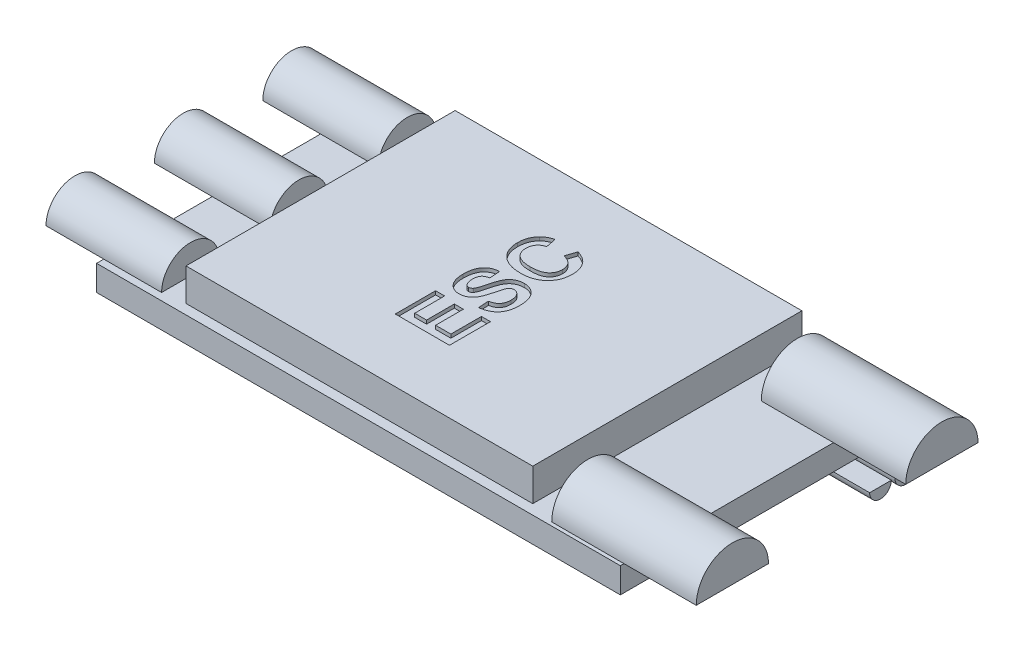
from build123d import *

# Parameters (mm, degrees)
SKETCH1_W           = 29
SKETCH1_H           = 16
BOSS_EXTRUDE1_DEPTH = 0.7
SKETCH2_W           = 19.2
SKETCH2_H           = 14.9
BOSS_EXTRUDE2_DEPTH = 1.8
SKETCH3_W           = 4
SKETCH3_H           = 2
REVOLVE1_ANGLE      = 180
SKETCH4_W           = 3.2
SKETCH4_H           = 1.6
REVOLVE2_ANGLE      = 180
SKETCH5_W           = 3.2
SKETCH5_H           = 1.6
REVOLVE3_ANGLE      = 180
SKETCH6_W           = 2
SKETCH6_H           = 0.6
REVOLVE4_ANGLE      = 180
LPATTERN1_COUNT     = 3
LPATTERN1_PITCH     = 1.4
CUT_EXTRUDE1_DEPTH  = 0.2


with BuildPart() as part:
    # Sketch1 → Boss-Extrude1 (new, symmetric)
    with BuildSketch(Plane(origin=(0, 0, 0), x_dir=(1, 0, 0), z_dir=(0, 1, 0))):
        Rectangle(SKETCH1_W, SKETCH1_H)
    extrude(amount=BOSS_EXTRUDE1_DEPTH, both=True)

    # Sketch2 → Boss-Extrude2 (add)
    with BuildSketch(Plane(origin=(0, 0.7, 0), x_dir=(1, 0, 0), z_dir=(0, 1, 0))):
        with Locations((-0.5, 0)):
            Rectangle(SKETCH2_W, SKETCH2_H)
    extrude(amount=BOSS_EXTRUDE2_DEPTH)

    # Sketch3 → Revolve1 (revolve)
    with BuildSketch(Plane(origin=(0, 0.7, 0), x_dir=(1, 0, 0), z_dir=(0, 1, 0))):
        with Locations((12.5, -4.8)):
            Rectangle(SKETCH3_W, SKETCH3_H)
        with Locations((16.5, -4.8)):
            Rectangle(SKETCH3_W, SKETCH3_H)
    revolve1 = revolve(axis=Axis((10.5, 0.7, 5.8), (1, 0, 0)), revolution_arc=REVOLVE1_ANGLE)

    # Sketch4 → Revolve2 (revolve)
    with BuildSketch(Plane(origin=(0, 0.7, 0), x_dir=(1, 0, 0), z_dir=(0, 1, 0))):
        with Locations((-16.1, 0.8)):
            Rectangle(SKETCH4_W, SKETCH4_H)
        with Locations((-12.9, 0.8)):
            Rectangle(SKETCH4_W, SKETCH4_H)
    revolve(axis=Axis((-17.7, 0.7, 0), (1, 0, 0)), revolution_arc=REVOLVE2_ANGLE)

    # Sketch5 → Revolve3 (revolve)
    with BuildSketch(Plane(origin=(0, 0.7, 0), x_dir=(1, 0, 0), z_dir=(0, 1, 0))):
        with Locations((-16.1, -5.2)):
            Rectangle(SKETCH5_W, SKETCH5_H)
        with Locations((-12.9, -5.2)):
            Rectangle(SKETCH5_W, SKETCH5_H)
    revolve3 = revolve(axis=Axis((-17.7, 0.7, 6), (1, 0, 0)), revolution_arc=REVOLVE3_ANGLE)

    # Mirror1: Revolve1, Revolve3 across plane
    add(revolve1.mirror(Plane.XY))
    add(revolve3.mirror(Plane.XY))

    # Sketch6 → Revolve4 (revolve)
    with BuildSketch(Plane.XZ.offset(0.7)):
        with Locations((13.5, -6.9)):
            Rectangle(SKETCH6_W, SKETCH6_H)
        with Locations((15.5, -6.9)):
            Rectangle(SKETCH6_W, SKETCH6_H)
    revolve4 = revolve(axis=Axis((12.5, -0.7, -7.2), (1, 0, 0)), revolution_arc=REVOLVE4_ANGLE)

    # LPattern1: Revolve4 ×3
    with Locations(*[(0, 0, i * LPATTERN1_PITCH) for i in range(1, LPATTERN1_COUNT)]):
        add(revolve4)

    # Sketch7 → Cut-Extrude1 (cut)
    with BuildSketch(Plane(origin=(0, 2.5, 0), x_dir=(1, 0, 0), z_dir=(0, 1, 0))):
        with BuildLine():
            Line((-0.115384615, 3.5), (0.076923077, 4.076923077))
            add(Edge.make_bspline(
                [(0.076923077, 4.076923077), (0.114750402, 4.065198159), (0.188828203, 4.042237081), (0.295000431, 4.000077848), (0.393390754, 3.951865071), (0.485170733, 3.899351596), (0.567898901, 3.839203039), (0.644462557, 3.775117808), (0.712460788, 3.70423645), (0.773496322, 3.628274922), (0.827172253, 3.546761084), (0.873588033, 3.459843465), (0.912631427, 3.367671275), (0.94447772, 3.270116415), (0.969914847, 3.167544261), (0.986732585, 3.059528105), (0.998130898, 2.946557928), (0.999367089, 2.869420867), (1, 2.829927885)],
                knots=[0, 0, 0, 0, 1.126731846, 2.206495396, 3.246709377, 4.243024494, 5.211217468, 6.153555546, 7.080823308, 8.001390448, 8.923174699, 9.854062736, 10.801713968, 11.767975006, 12.771764216, 13.805490997, 14.876445307, 16, 16, 16, 16], degree=3))
            add(Edge.make_bspline(
                [(1, 2.829927885), (0.998992327, 2.781181627), (0.997010203, 2.68529628), (0.97704753, 2.545076052), (0.945922354, 2.411441066), (0.902755409, 2.284253603), (0.845806725, 2.164072923), (0.776248951, 2.050638712), (0.69460751, 1.943621612), (0.601135873, 1.8441618), (0.496788143, 1.754063389), (0.382408554, 1.675307827), (0.258665866, 1.609287739), (0.126032708, 1.554798483), (-0.015964032, 1.512813669), (-0.167067967, 1.483212087), (-0.327266255, 1.464729647), (-0.43704753, 1.462620776), (-0.493389423, 1.461538462)],
                knots=[0, 0, 0, 0, 1.025143361, 2.016487647, 2.973470535, 3.909229238, 4.836912068, 5.765858094, 6.70417655, 7.664375231, 8.632718049, 9.599637839, 10.580278406, 11.578303177, 12.611869726, 13.690654642, 14.814798883, 16, 16, 16, 16], degree=3))
            add(Edge.make_bspline(
                [(-0.493389423, 1.461538462), (-0.55273558, 1.462615292), (-0.668509104, 1.464715992), (-0.836836659, 1.483241525), (-0.995465336, 1.512021861), (-1.143458199, 1.554237401), (-1.281858809, 1.607645271), (-1.409541614, 1.673893233), (-1.527220855, 1.752058499), (-1.634238736, 1.841374214), (-1.728915162, 1.941330431), (-1.811877898, 2.048755941), (-1.882154755, 2.163749492), (-1.939503083, 2.286522027), (-1.983926957, 2.416942462), (-2.015903889, 2.554806045), (-2.034519331, 2.700211252), (-2.037129492, 2.79962607), (-2.038461538, 2.850360577)],
                knots=[0, 0, 0, 0, 1.21258364, 2.365529433, 3.456816616, 4.503979614, 5.50606293, 6.48392428, 7.437774563, 8.388174149, 9.326458891, 10.246094529, 11.157518439, 12.075155987, 13.009968439, 13.968342023, 14.963181076, 16, 16, 16, 16], degree=3))
            add(Edge.make_bspline(
                [(-2.038461538, 2.850360577), (-2.037351607, 2.894671145), (-2.035175438, 2.98154791), (-2.020211657, 3.108732722), (-1.994430248, 3.229468311), (-1.958018756, 3.343615263), (-1.912664185, 3.4519673), (-1.855590171, 3.553234069), (-1.788836643, 3.648613256), (-1.736622006, 3.706057732), (-1.710336538, 3.734975962)],
                knots=[0, 0, 0, 0, 1.098573301, 2.153899152, 3.169959448, 4.154852821, 5.120726819, 6.076884781, 7.031881026, 8, 8, 8, 8], degree=3))
            add(Edge.make_bspline(
                [(-1.710336538, 3.734975962), (-1.693615488, 3.751740031), (-1.659780623, 3.785661947), (-1.602633883, 3.830917083), (-1.541073201, 3.874091995), (-1.473842227, 3.913440966), (-1.401293775, 3.949605302), (-1.323727573, 3.982413111), (-1.240997182, 4.012875115), (-1.183402425, 4.029784197), (-1.153846154, 4.038461538)],
                knots=[0, 0, 0, 0, 0.885321605, 1.791438769, 2.723025903, 3.697505786, 4.703199598, 5.754404901, 6.847613555, 8, 8, 8, 8], degree=3))
            Line((-1.153846154, 4.038461538), (-1.038461538, 3.461538462))
            add(Edge.make_bspline(
                [(-1.038461538, 3.461538462), (-1.057384649, 3.456634853), (-1.094658212, 3.446976029), (-1.148218274, 3.427432715), (-1.19904199, 3.405014992), (-1.245884509, 3.377230278), (-1.290829723, 3.347715728), (-1.331881925, 3.312772165), (-1.370117003, 3.274631209), (-1.405138169, 3.233018098), (-1.436237768, 3.188428921), (-1.46419437, 3.141722177), (-1.487015693, 3.092048951), (-1.50547809, 3.040070021), (-1.520957419, 2.985992414), (-1.530519721, 2.929334672), (-1.537860479, 2.870583421), (-1.538258249, 2.830554112), (-1.538461538, 2.810096154)],
                knots=[0, 0, 0, 0, 1.051226935, 2.070641259, 3.064374968, 4.034983734, 4.997599858, 5.953980297, 6.92954377, 7.901109626, 8.875958313, 9.851998019, 10.826131395, 11.811470594, 12.818270757, 13.847890818, 14.900111925, 16, 16, 16, 16], degree=3))
            add(Edge.make_bspline(
                [(-1.538461538, 2.810096154), (-1.537894143, 2.782000942), (-1.536786758, 2.727167496), (-1.524440157, 2.647020013), (-1.507209197, 2.570630352), (-1.480897612, 2.498306589), (-1.447245311, 2.430496606), (-1.406337177, 2.366429739), (-1.358348429, 2.306457619), (-1.302710557, 2.250559979), (-1.238417603, 2.200399445), (-1.165336823, 2.156301175), (-1.082638516, 2.119717708), (-0.991134211, 2.09001775), (-0.890606311, 2.066640499), (-0.780925882, 2.049947302), (-0.662017892, 2.040715462), (-0.579743077, 2.039229059), (-0.537259615, 2.038461538)],
                knots=[0, 0, 0, 0, 0.938194206, 1.831074359, 2.704771284, 3.551924377, 4.396294915, 5.230222094, 6.087631332, 6.958733431, 7.860107878, 8.806247581, 9.804197948, 10.875520245, 12.017191412, 13.250061517, 14.580040491, 16, 16, 16, 16], degree=3))
            add(Edge.make_bspline(
                [(-0.537259615, 2.038461538), (-0.492173056, 2.039222043), (-0.4052982, 2.040687417), (-0.279987032, 2.04991009), (-0.164741832, 2.066734461), (-0.059509695, 2.089678731), (0.035725152, 2.11971784), (0.121014514, 2.156350481), (0.196803383, 2.199195535), (0.261797492, 2.250012631), (0.31786565, 2.305791872), (0.36683154, 2.365267545), (0.408033013, 2.429036363), (0.44203982, 2.496622792), (0.467723896, 2.568582744), (0.486361458, 2.644273136), (0.498206888, 2.723985824), (0.499393919, 2.778603419), (0.5, 2.806490385)],
                knots=[0, 0, 0, 0, 1.475358314, 2.842788217, 4.10813974, 5.28337307, 6.36340737, 7.370420267, 8.315974046, 9.203613532, 10.061092951, 10.899546145, 11.719527401, 12.540320428, 13.369705655, 14.21387866, 15.088031885, 16, 16, 16, 16], degree=3))
            add(Edge.make_bspline(
                [(0.5, 2.806490385), (0.499484902, 2.827136912), (0.498472038, 2.867735242), (0.492043466, 2.927742703), (0.479775465, 2.985337628), (0.463553253, 3.040801926), (0.443199163, 3.094351092), (0.417088958, 3.145168328), (0.387079155, 3.194253439), (0.351909966, 3.240587949), (0.312425836, 3.284792301), (0.266792022, 3.325109292), (0.216105002, 3.362506649), (0.160026033, 3.396509929), (0.099035131, 3.42825529), (0.032182025, 3.455264405), (-0.039452908, 3.480425817), (-0.089631965, 3.49336131), (-0.115384615, 3.5)],
                knots=[0, 0, 0, 0, 0.980177776, 1.927374078, 2.859849964, 3.771585772, 4.668674471, 5.574490016, 6.479656464, 7.396337719, 8.332153134, 9.288470092, 10.28125149, 11.318486971, 12.398724812, 13.541284404, 14.738150009, 16, 16, 16, 16], degree=3))
        make_face()
        with BuildLine():
            Line((0, -1.346153846), (-0.038461538, -0.769230769))
            add(Edge.make_bspline(
                [(-0.038461538, -0.769230769), (-0.014325164, -0.764634519), (0.032558209, -0.755706595), (0.099374322, -0.735871641), (0.161662546, -0.714034582), (0.218770122, -0.687953248), (0.271699482, -0.659349168), (0.319003367, -0.626192827), (0.361676996, -0.58993954), (0.399076573, -0.549814027), (0.432624467, -0.506455628), (0.460522601, -0.458685567), (0.484808183, -0.407883833), (0.504755579, -0.353619102), (0.519659686, -0.295388137), (0.530259434, -0.233682545), (0.537048183, -0.168418288), (0.537982708, -0.123815187), (0.538461538, -0.100961538)],
                knots=[0, 0, 0, 0, 1.204677245, 2.340008924, 3.41562088, 4.44046575, 5.417001248, 6.3630415, 7.269134822, 8.159094629, 9.049542694, 9.952967105, 10.867337362, 11.809438639, 12.784390299, 13.812011701, 14.878922867, 16, 16, 16, 16], degree=3))
            add(Edge.make_bspline(
                [(0.538461538, -0.100961538), (0.538196971, -0.076907361), (0.537682375, -0.030120747), (0.531378881, 0.037690068), (0.522206073, 0.101053182), (0.508173621, 0.159660724), (0.49093623, 0.213805017), (0.470034997, 0.26353944), (0.444569898, 0.308485349), (0.415173185, 0.348517771), (0.383318612, 0.383689474), (0.350579452, 0.414894584), (0.316599964, 0.441512782), (0.280459955, 0.462666779), (0.243555127, 0.479752133), (0.204831251, 0.491052021), (0.165165481, 0.49868373), (0.138057061, 0.499559009), (0.124399038, 0.5)],
                knots=[0, 0, 0, 0, 1.418030258, 2.758141892, 4.012849053, 5.190504034, 6.307525772, 7.360759663, 8.365925826, 9.346494891, 10.283396317, 11.160841652, 12.011476082, 12.821866951, 13.625513811, 14.402856512, 15.195311921, 16, 16, 16, 16], degree=3))
            add(Edge.make_bspline(
                [(0.124399038, 0.5), (0.107288293, 0.499456629), (0.073813622, 0.498393602), (0.025929415, 0.485692836), (-0.018475972, 0.46639367), (-0.059089598, 0.43800515), (-0.095895755, 0.399284321), (-0.129496324, 0.349618425), (-0.160546832, 0.288515152), (-0.177745659, 0.242982768), (-0.186899038, 0.21875)],
                knots=[0, 0, 0, 0, 0.904653283, 1.769821757, 2.60630992, 3.46039906, 4.376381456, 5.421829955, 6.627873392, 8, 8, 8, 8], degree=3))
            add(Edge.make_bspline(
                [(-0.186899038, 0.21875), (-0.190381689, 0.208357275), (-0.198175294, 0.185100043), (-0.209319416, 0.145425675), (-0.223235462, 0.097636844), (-0.23905327, 0.041042973), (-0.255230724, -0.02433691), (-0.275159512, -0.097772597), (-0.294990285, -0.18015935), (-0.309629357, -0.237797221), (-0.317307692, -0.268028846)],
                knots=[0, 0, 0, 0, 0.521821638, 1.167752076, 1.961721917, 2.891982557, 3.96540661, 5.168436773, 6.514817513, 8, 8, 8, 8], degree=3))
            add(Edge.make_bspline(
                [(-0.317307692, -0.268028846), (-0.327145249, -0.307396245), (-0.346125207, -0.383349205), (-0.379760539, -0.491726336), (-0.413605954, -0.591291294), (-0.448821325, -0.682039298), (-0.486655952, -0.763306036), (-0.526165732, -0.83539051), (-0.566851751, -0.898916843), (-0.597210812, -0.935953588), (-0.611778846, -0.953725962)],
                knots=[0, 0, 0, 0, 1.293827876, 2.496229314, 3.617486305, 4.647214227, 5.598941135, 6.473853732, 7.267666729, 8, 8, 8, 8], degree=3))
            add(Edge.make_bspline(
                [(-0.611778846, -0.953725962), (-0.632413082, -0.975764124), (-0.672868411, -1.018971978), (-0.739344279, -1.075848412), (-0.809565398, -1.123640104), (-0.883013443, -1.162977899), (-0.960111249, -1.193267257), (-1.040342757, -1.214735964), (-1.123917363, -1.228631291), (-1.180833649, -1.230049214), (-1.209735577, -1.230769231)],
                knots=[0, 0, 0, 0, 1.064429417, 2.086912298, 3.078678339, 4.055528992, 5.020032834, 5.993708893, 6.981211098, 8, 8, 8, 8], degree=3))
            add(Edge.make_bspline(
                [(-1.209735577, -1.230769231), (-1.246925124, -1.229326862), (-1.321090592, -1.22645041), (-1.430054541, -1.201332524), (-1.535233017, -1.16100271), (-1.619021693, -1.115407741), (-1.682339616, -1.07096709), (-1.727701632, -1.034210187), (-1.770148503, -0.993812107), (-1.808654955, -0.949239634), (-1.845473756, -0.902142462), (-1.878169438, -0.850697351), (-1.908966919, -0.796362523), (-1.945475915, -0.717733871), (-1.98352187, -0.610977725), (-2.015592197, -0.472082249), (-2.034870606, -0.320852578), (-2.037235659, -0.216004582), (-2.038461538, -0.161658654)],
                knots=[0, 0, 0, 0, 1.173854899, 2.340966893, 3.512960251, 4.725330002, 5.343426374, 5.955334136, 6.568647945, 7.192068799, 7.814943173, 8.455761621, 9.116040544, 9.787122478, 11.192596942, 12.687979905, 14.283278534, 16, 16, 16, 16], degree=3))
            add(Edge.make_bspline(
                [(-2.038461538, -0.161658654), (-2.037866482, -0.117160162), (-2.03670911, -0.030611546), (-2.02500558, 0.094850725), (-2.00679042, 0.212039294), (-1.980642643, 0.320542931), (-1.946094565, 0.420412193), (-1.904941273, 0.512034201), (-1.856081989, 0.595331098), (-1.799236327, 0.669288829), (-1.73656763, 0.735178078), (-1.668115224, 0.79265591), (-1.594743622, 0.841942074), (-1.516506443, 0.883354658), (-1.433001434, 0.915875851), (-1.344332791, 0.939761383), (-1.25070922, 0.955559482), (-1.186557414, 0.959519323), (-1.153846154, 0.961538462)],
                knots=[0, 0, 0, 0, 1.325124071, 2.577337985, 3.749592149, 4.855247722, 5.896868755, 6.892903601, 7.842551483, 8.766257401, 9.665194363, 10.546067736, 11.423174165, 12.293291263, 13.177512979, 14.086532529, 15.024315359, 16, 16, 16, 16], degree=3))
            Line((-1.153846154, 0.961538462), (-1.115384615, 0.384615385))
            add(Edge.make_bspline(
                [(-1.115384615, 0.384615385), (-1.133475993, 0.381288309), (-1.168734206, 0.374804185), (-1.21922089, 0.360687014), (-1.26595287, 0.344830256), (-1.308920446, 0.32597047), (-1.347619236, 0.304053674), (-1.382273217, 0.279027624), (-1.413286287, 0.251866092), (-1.440609282, 0.221806398), (-1.463671321, 0.187761085), (-1.484214353, 0.150712884), (-1.500964324, 0.109265563), (-1.514763926, 0.064006934), (-1.525353743, 0.014736083), (-1.533309298, -0.038235542), (-1.537170598, -0.095095913), (-1.538021374, -0.134210476), (-1.538461538, -0.154447115)],
                knots=[0, 0, 0, 0, 1.150855866, 2.242898388, 3.27787599, 4.237823789, 5.175651342, 6.056061848, 6.908895975, 7.75236871, 8.590605917, 9.477244771, 10.399349179, 11.382998967, 12.435674925, 13.55107929, 14.733005797, 16, 16, 16, 16], degree=3))
            add(Edge.make_bspline(
                [(-1.538461538, -0.154447115), (-1.538073505, -0.175487997), (-1.537318567, -0.216423973), (-1.532685629, -0.276078601), (-1.524133671, -0.332039118), (-1.513001143, -0.384580361), (-1.497856108, -0.433632148), (-1.479389219, -0.479090966), (-1.457648006, -0.52116479), (-1.44054277, -0.546819574), (-1.432091346, -0.559495192)],
                knots=[0, 0, 0, 0, 1.186678824, 2.308736671, 3.37120409, 4.377216403, 5.334874112, 6.262130804, 7.141346615, 8, 8, 8, 8], degree=3))
            add(Edge.make_bspline(
                [(-1.432091346, -0.559495192), (-1.420546461, -0.574001373), (-1.398187603, -0.602095343), (-1.353790513, -0.6323304), (-1.30364533, -0.650531974), (-1.268184264, -0.65272274), (-1.25, -0.653846154)],
                knots=[0, 0, 0, 0, 1.037857257, 2.010007357, 2.979541333, 4, 4, 4, 4], degree=3))
            add(Edge.make_bspline(
                [(-1.25, -0.653846154), (-1.233005598, -0.652927406), (-1.19952933, -0.651117618), (-1.151975567, -0.632863582), (-1.107913585, -0.60479136), (-1.083978539, -0.578562474), (-1.071514423, -0.564903846)],
                knots=[0, 0, 0, 0, 0.98538058, 1.941042925, 2.927803204, 4, 4, 4, 4], degree=3))
            add(Edge.make_bspline(
                [(-1.071514423, -0.564903846), (-1.063196815, -0.554085514), (-1.0446985, -0.530025604), (-1.02170651, -0.485578694), (-0.997619627, -0.431759761), (-0.973224928, -0.367863345), (-0.948122552, -0.29412071), (-0.922811589, -0.210149149), (-0.898013645, -0.115995002), (-0.872872115, -0.014504313), (-0.8484856, 0.088681015), (-0.821724378, 0.187124178), (-0.795656834, 0.278667927), (-0.768328055, 0.362880235), (-0.74172485, 0.440196976), (-0.714401211, 0.510242307), (-0.687790818, 0.573496729), (-0.651200916, 0.647260178), (-0.601630364, 0.73085241), (-0.529607844, 0.818514893), (-0.448640241, 0.895754438), (-0.372732432, 0.950114618), (-0.307143261, 0.987036633), (-0.254659976, 1.011093565), (-0.199188363, 1.031475296), (-0.141005065, 1.048447175), (-0.07999726, 1.060607706), (-0.016512561, 1.070702575), (0.049993638, 1.075853969), (0.095345453, 1.076562872), (0.118389423, 1.076923077)],
                knots=[0, 0, 0, 0, 0.516255311, 1.148148894, 1.888861859, 2.751620851, 3.738268431, 4.840557414, 6.07428004, 7.42751106, 8.802854092, 10.091833706, 11.293062756, 12.409377658, 13.44651028, 14.39102378, 15.258213098, 16.045831186, 17.510454751, 18.929597364, 20.331088364, 21.740370042, 22.45410143, 23.180993031, 23.925547029, 24.691954406, 25.475059937, 26.281333581, 27.126718562, 28, 28, 28, 28], degree=3))
            add(Edge.make_bspline(
                [(0.118389423, 1.076923077), (0.139641222, 1.076428128), (0.181845237, 1.075445206), (0.24448572, 1.068572604), (0.306017488, 1.057954319), (0.36650024, 1.042198586), (0.425705699, 1.021493961), (0.484424093, 0.997701309), (0.541752277, 0.96850108), (0.597664247, 0.935042747), (0.651989533, 0.898154784), (0.702174317, 0.856409692), (0.74963757, 0.811883239), (0.792837162, 0.763022398), (0.832509291, 0.710397825), (0.869417266, 0.654702306), (0.901754689, 0.594801938), (0.930707153, 0.531572876), (0.955854228, 0.46440682), (0.978260365, 0.39347109), (0.996591803, 0.318104032), (1.012306003, 0.238940493), (1.024255764, 0.155688945), (1.032599604, 0.068453988), (1.037304996, -0.022784355), (1.038071234, -0.084930655), (1.038461538, -0.116586538)],
                knots=[0, 0, 0, 0, 0.900673708, 1.788650733, 2.668102459, 3.545420189, 4.434208745, 5.325103822, 6.228854033, 7.15789738, 8.085853671, 9.00886332, 9.921780837, 10.841974279, 11.769192201, 12.713551961, 13.671065578, 14.651348434, 15.659047947, 16.709071323, 17.802583073, 18.944913937, 20.128896835, 21.365799559, 22.658199399, 24, 24, 24, 24], degree=3))
            add(Edge.make_bspline(
                [(1.038461538, -0.116586538), (1.037713856, -0.162292266), (1.036258101, -0.2512824), (1.023273178, -0.380577131), (1.00329864, -0.501817468), (0.974633801, -0.615005501), (0.936675404, -0.719743736), (0.890985413, -0.81645495), (0.837297434, -0.905275695), (0.774354192, -0.985388651), (0.703715289, -1.057775325), (0.625683365, -1.12262311), (0.539894852, -1.179152556), (0.446595706, -1.228032159), (0.345744593, -1.269417768), (0.237494019, -1.303744524), (0.121384471, -1.329553633), (0.041161272, -1.340524742), (0, -1.346153846)],
                knots=[0, 0, 0, 0, 1.218139507, 2.37174651, 3.460374984, 4.491365737, 5.47959152, 6.425515823, 7.338627716, 8.240236466, 9.135242029, 10.030263523, 10.939666966, 11.868877268, 12.833814776, 13.842095051, 14.892812657, 16, 16, 16, 16], degree=3))
        make_face()
        Polygon((1, -3.961538462), (-2, -3.961538462), (-2, -1.730769231), (-1.5, -1.730769231), (-1.5, -3.384615385), (-0.846153846, -3.384615385), (-0.846153846, -1.846153846), (-0.346153846, -1.846153846), (-0.346153846, -3.384615385), (0.5, -3.384615385), (0.5, -1.692307692), (1, -1.692307692), align=None)
    extrude(amount=-CUT_EXTRUDE1_DEPTH, mode=Mode.SUBTRACT)


solid = part.part
